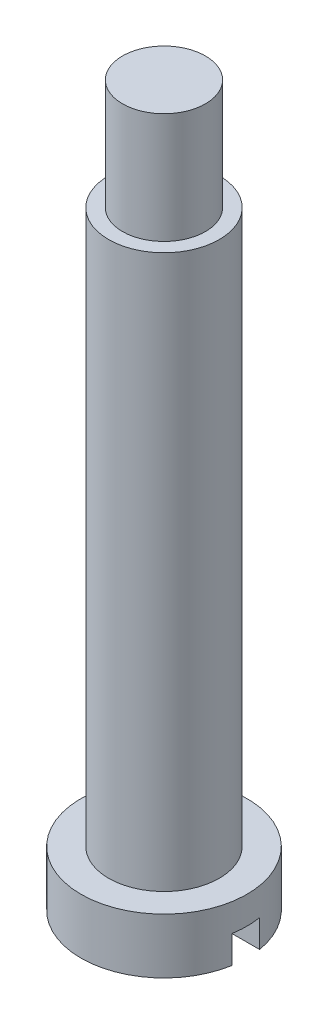
from build123d import *

# Parameters (mm, degrees)
SKETCH_1_R               = 3
EXTRUDE_1_DEPTH          = 2
SKETCH_2_R               = 2
EXTRUDE_2_DEPTH          = 20
SKETCH_3_R               = 1.5
EXTRUDE_3_DEPTH          = 4
CUT_EXTRUDE_1_DEPTH      = 27.343879745
CUT_EXTRUDE_1_DEPTH_BACK = 1
SKETCH_4_W               = 6
SKETCH_4_H               = 1


with BuildPart() as part:
    # 草图1 → 凸台-拉伸1 (new body)
    with BuildSketch(Plane(origin=(0, 0, 0), x_dir=(1, 0, 0), z_dir=(0, 1, 0))):
        Circle(SKETCH_1_R)
    extrude(amount=-EXTRUDE_1_DEPTH)

    # 草图2 → 凸台-拉伸2 (add)
    with BuildSketch(Plane(origin=(0, 0, 0), x_dir=(1, 0, 0), z_dir=(0, 1, 0))):
        Circle(SKETCH_2_R)
    extrude(amount=EXTRUDE_2_DEPTH)

    # 草图3 → 凸台-拉伸3 (add)
    with BuildSketch(Plane(origin=(0, 20, 0), x_dir=(1, 0, 0), z_dir=(0, 1, 0))):
        Circle(SKETCH_3_R)
    extrude(amount=EXTRUDE_3_DEPTH)

    # 草图4 → 切除-拉伸-薄壁1 (cut, two sides: drawn at the far end of the back side and taken through both)
    with BuildSketch(Plane.XZ.offset(2).offset(-CUT_EXTRUDE_1_DEPTH_BACK)):
        Rectangle(SKETCH_4_W, SKETCH_4_H)
    extrude(amount=CUT_EXTRUDE_1_DEPTH + CUT_EXTRUDE_1_DEPTH_BACK, mode=Mode.SUBTRACT)


solid = part.part
